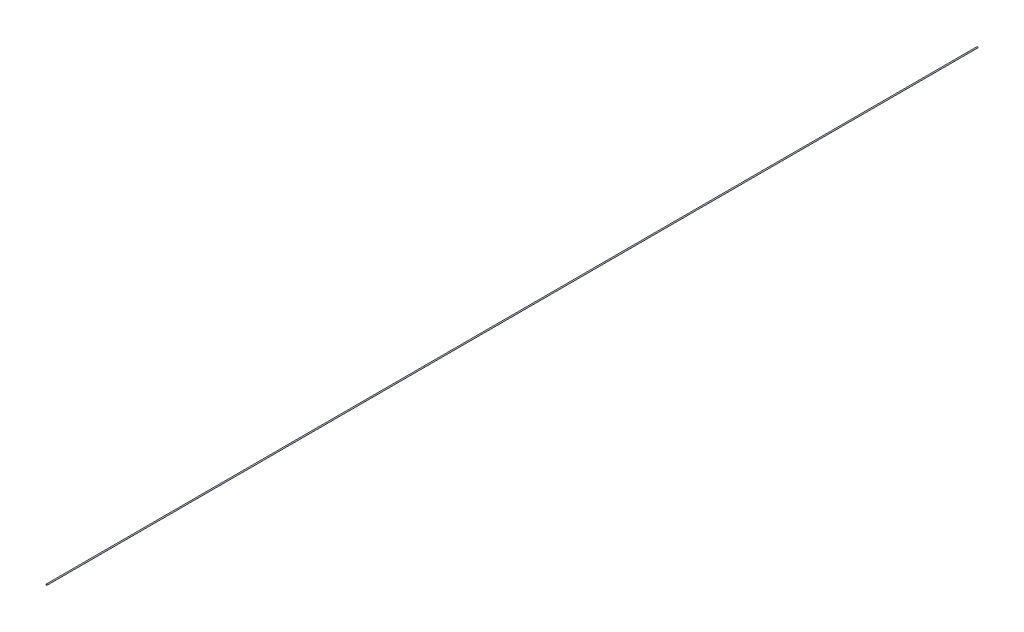
from build123d import *

# Parameters (mm, degrees)
SKETCH_1_R      = 3
EXTRUDE_1_DEPTH = 5000


with BuildPart() as part:
    # 草图1 → 凸台-拉伸1 (new body)
    with BuildSketch(Plane.XY):
        Circle(SKETCH_1_R)
    extrude(amount=EXTRUDE_1_DEPTH)


solid = part.part
